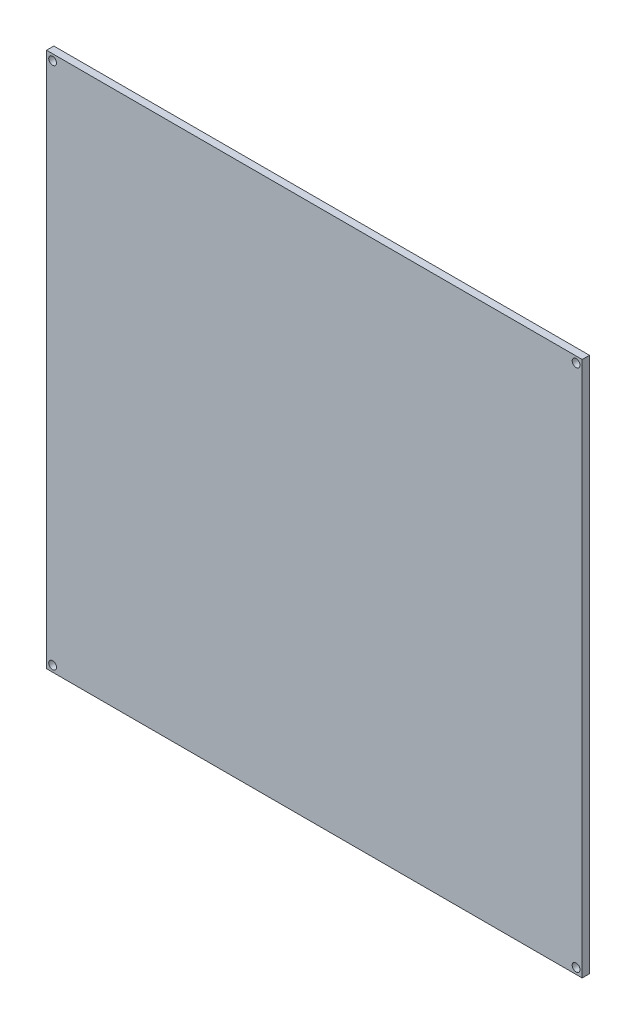
from build123d import *

# Parameters (mm, degrees)
ESQUISSE1_W        = 220
ESQUISSE1_H        = 220
ESQUISSE1_R        = 1.6
BOSS_EXTRU_1_DEPTH = 3


with BuildPart() as part:
    # Esquisse1 → Boss.-Extru.1 (new body)
    with BuildSketch(Plane.XY):
        Rectangle(ESQUISSE1_W, ESQUISSE1_H)
        with Locations((-107.5, 107.5)):
            Circle(ESQUISSE1_R, mode=Mode.SUBTRACT)
        with Locations((107.5, 107.5)):
            Circle(ESQUISSE1_R, mode=Mode.SUBTRACT)
        with Locations((107.5, -107.5)):
            Circle(ESQUISSE1_R, mode=Mode.SUBTRACT)
        with Locations((-107.5, -107.5)):
            Circle(ESQUISSE1_R, mode=Mode.SUBTRACT)
    extrude(amount=BOSS_EXTRU_1_DEPTH)


solid = part.part
